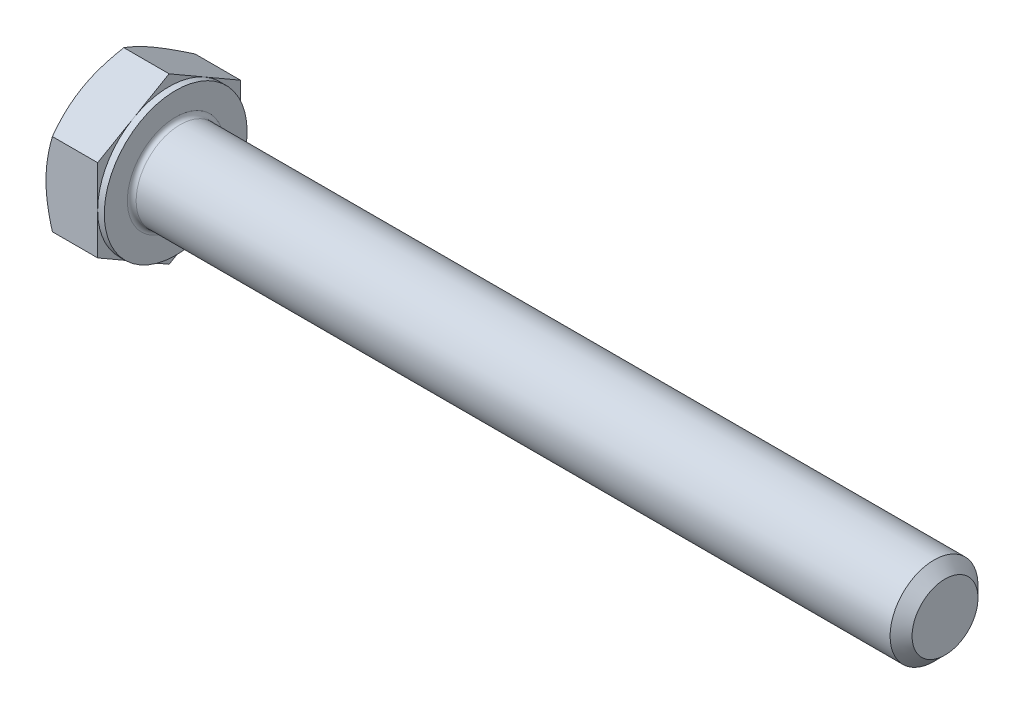
from build123d import *

# Parameters (mm, degrees)
EXTRUDE_371_DEPTH = 5.3
SKETCH_4_W        = 0.6
SKETCH_4_H        = 11.005553499
CHAMFER_2031_SIZE = 1
FILLET_2073_R     = 0.4


with BuildPart() as part:
    # 草图1 → Extrude 371 (new body)
    with BuildSketch(Plane(origin=(0, 0, 0), x_dir=(0, 0, -1), z_dir=(1, 0, 0))):
        Polygon((6.5, 3.75277675), (6.5, -3.75277675), (0, -7.505553499), (-6.5, -3.75277675), (-6.5, 3.75277675), (0, 7.505553499), align=None)
    extrude(amount=EXTRUDE_371_DEPTH)

    # 草图2 → 凸台-旋转1 (revolve)
    with BuildSketch(Plane.XY, mode=Mode.PRIVATE) as revolve_1_sk:
        Polygon((0, 0), (75.3, 0), (75.3, 2.9175), (75.3, 4), (27.8072, 4), (0, 4), align=None)
    revolve(revolve_1_sk.sketch.rotate(Axis((0, 0, 0), (1, 0, 0)), 90), axis=Axis((0, 0, 0), (1, 0, 0)))

    # 草图3 → 切除-旋转1 (revolve, cut)
    with BuildSketch(Plane.XY):
        Polygon((0, 6.5), (3.46730793, 12.505553499), (3.46730793, 17.505553499), (-10, 17.505553499), (-10, 6.5), align=None)
    revolve(axis=Axis((0, 0, 0), (1, 0, 0)), mode=Mode.SUBTRACT)

    # 草图5 → 切除-旋转2 (revolve, cut)
    with BuildSketch(Plane.XY):
        Polygon((5.3, 6.5), (1.83269207, 12.505553499), (1.83269207, 17.505553499), (11.83269207, 17.505553499), (11.83269207, 6.5), align=None)
    revolve(axis=Axis((0, 0, 0), (1, 0, 0)), mode=Mode.SUBTRACT)

    # 草图4 → 切除-旋转3 (revolve, cut)
    with BuildSketch(Plane.XY, mode=Mode.PRIVATE) as cut_revolve_3_sk:
        with Locations((5, 12.00277675)):
            Rectangle(SKETCH_4_W, SKETCH_4_H)
    revolve(cut_revolve_3_sk.sketch.rotate(Axis((0, 0, 0), (1, 0, 0)), 270), axis=Axis((0, 0, 0), (1, 0, 0)), mode=Mode.SUBTRACT)

    # Chamfer 2031
    chamfer_2031_edges = [part.edges().sort_by_distance(p)[0] for p in [
        (75.3, 0, -4),
    ]]
    chamfer(chamfer_2031_edges, length=CHAMFER_2031_SIZE)

    # Fillet 2073
    fillet_2073_edges = [part.edges().sort_by_distance(p)[0] for p in [
        (5.3, 0, -4),
    ]]
    fillet(fillet_2073_edges, radius=FILLET_2073_R)


solid = part.part
